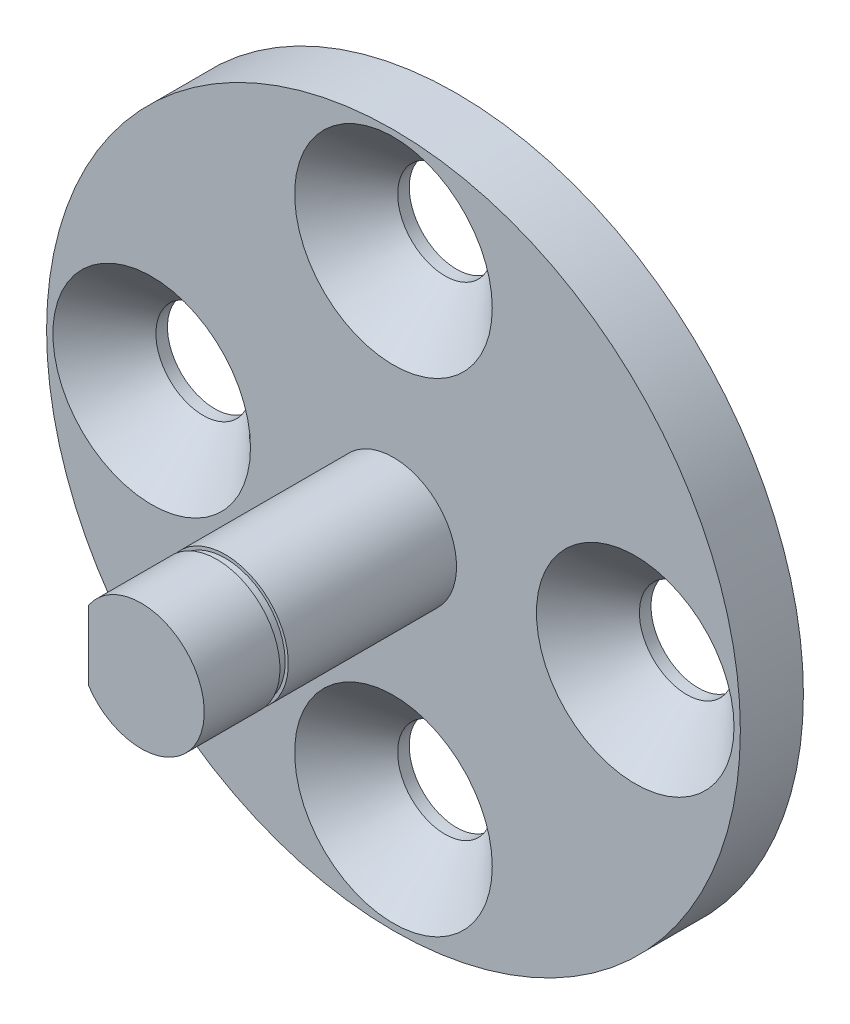
from build123d import *

# Parameters (mm, degrees)
SKETCH1_R                                      = 16.5
BOSS_EXTRUDE1_DEPTH                            = 3
SKETCH2_R                                      = 3
BOSS_EXTRUDE2_DEPTH                            = 12
SKETCH3_R                                      = 6
BOSS_EXTRUDE3_DEPTH                            = 1
CUT_EXTRUDE1_START                             = -11
CUT_EXTRUDE1_DEPTH                             = 11
SKETCH5_R                                      = 2
CUT_EXTRUDE2_DEPTH                             = 27.239283527
CIRPATTERN1_COUNT                              = 4
CSK_FOR_M4_FLAT_HEAD_MACHINE_SCREW1_AT_2_COUNT = 2
CSK_FOR_M4_FLAT_HEAD_MACHINE_SCREW1_AT_2_PITCH = 16.263455967
CSK_FOR_M4_FLAT_HEAD_MACHINE_SCREW1_AT_3_COUNT = 2
CSK_FOR_M4_FLAT_HEAD_MACHINE_SCREW1_AT_3_PITCH = 23
CSK_FOR_M4_FLAT_HEAD_MACHINE_SCREW1_AT_4_COUNT = 2
CSK_FOR_M4_FLAT_HEAD_MACHINE_SCREW1_AT_4_PITCH = 16.263455967
CUT_EXTRUDE3_START                             = -1
SKETCH9_R                                      = 6
CUT_EXTRUDE3_DEPTH                             = 1
SKETCH10_W                                     = 0.3
SKETCH10_H                                     = 0.4


with BuildPart() as part:
    # Sketch1 → Boss-Extrude1 (new body)
    with BuildSketch(Plane.XY):
        Circle(SKETCH1_R)
    extrude(amount=BOSS_EXTRUDE1_DEPTH)

    # Sketch2 → Boss-Extrude2 (add)
    with BuildSketch(Plane.XY.offset(3)):
        Circle(SKETCH2_R)
    extrude(amount=BOSS_EXTRUDE2_DEPTH)

    # Sketch3 → Boss-Extrude3 (add)
    with BuildSketch(Plane.XY.offset(3)):
        Circle(SKETCH3_R)
    extrude(amount=BOSS_EXTRUDE3_DEPTH)

    # Sketch4 → Cut-Extrude1 (cut)
    with BuildSketch(Plane.XY.offset(15).offset(CUT_EXTRUDE1_START)):
        with BuildLine():
            Line((-2.5, -1.658312395), (-2.5, 1.658312395))
            ThreePointArc((-2.5, 1.658312395), (-3, 0), (-2.5, -1.658312395))
        make_face()
    extrude(amount=CUT_EXTRUDE1_DEPTH, mode=Mode.SUBTRACT)

    # Sketch5 → Cut-Extrude2 (cut, through all)
    with BuildSketch(Plane.XY.offset(3)):
        with Locations((0, 11.5)):
            Circle(SKETCH5_R)
    cut_extrude2 = extrude(amount=-CUT_EXTRUDE2_DEPTH, mode=Mode.SUBTRACT)

    # CirPattern1: Cut-Extrude2 ×4 about axis
    cirpattern1_axis = Axis((0, 0, 0), (0, 0, 1))
    for i in range(1, CIRPATTERN1_COUNT):
        add(cut_extrude2.rotate(cirpattern1_axis, i * 360 / CIRPATTERN1_COUNT), mode=Mode.SUBTRACT)

    # Sketch8 → CSK for M4 Flat Head Machine Screw1 (revolve, cut)
    with BuildSketch(Plane(origin=(-11.5, 0, 3), x_dir=(0, -1, 0), z_dir=(1, 0, 0))):
        Polygon((0, 0), (0, 3), (2.25, 3), (2.25, 2.45), (4.7, 0), align=None)
    csk_for_m4_flat_head_machine_screw1 = revolve(axis=Axis((-11.5, 0, 9.35), (0, 0, -1)), mode=Mode.SUBTRACT)

    # CSK for M4 Flat Head Machine Screw1 at 2: CSK for M4 Flat Head Machine Screw1 ×2
    with Locations(*[Vector(0.7071067811865462, 0.7071067811865488, 0) * (i * CSK_FOR_M4_FLAT_HEAD_MACHINE_SCREW1_AT_2_PITCH) for i in range(1, CSK_FOR_M4_FLAT_HEAD_MACHINE_SCREW1_AT_2_COUNT)]):
        add(csk_for_m4_flat_head_machine_screw1, mode=Mode.SUBTRACT)

    # CSK for M4 Flat Head Machine Screw1 at 3: CSK for M4 Flat Head Machine Screw1 ×2
    with Locations(*[(i * CSK_FOR_M4_FLAT_HEAD_MACHINE_SCREW1_AT_3_PITCH, 0, 0) for i in range(1, CSK_FOR_M4_FLAT_HEAD_MACHINE_SCREW1_AT_3_COUNT)]):
        add(csk_for_m4_flat_head_machine_screw1, mode=Mode.SUBTRACT)

    # CSK for M4 Flat Head Machine Screw1 at 4: CSK for M4 Flat Head Machine Screw1 ×2
    with Locations(*[Vector(0.7071067811865488, -0.7071067811865462, 0) * (i * CSK_FOR_M4_FLAT_HEAD_MACHINE_SCREW1_AT_4_PITCH) for i in range(1, CSK_FOR_M4_FLAT_HEAD_MACHINE_SCREW1_AT_4_COUNT)]):
        add(csk_for_m4_flat_head_machine_screw1, mode=Mode.SUBTRACT)

    # Sketch9 → Cut-Extrude3 (cut)
    with BuildSketch(Plane.XY.offset(4).offset(CUT_EXTRUDE3_START)):
        Circle(SKETCH9_R)
        with BuildLine():
            Line((-2.5, -1.658312395), (-2.5, 1.658312395))
            ThreePointArc((-2.5, 1.658312395), (3, 0), (-2.5, -1.658312395))
        make_face(mode=Mode.SUBTRACT)
    extrude(amount=CUT_EXTRUDE3_DEPTH, mode=Mode.SUBTRACT)

    # Sketch10 → Cut-Revolve1 (revolve, cut)
    with BuildSketch(Plane(origin=(0, 0, 0), x_dir=(1, 0, 0), z_dir=(0, 1, 0))):
        with Locations((3, -11.2)):
            Rectangle(SKETCH10_W, SKETCH10_H)
    revolve(axis=Axis((0, 0, 0), (0, 0, 1)), mode=Mode.SUBTRACT)


solid = part.part
